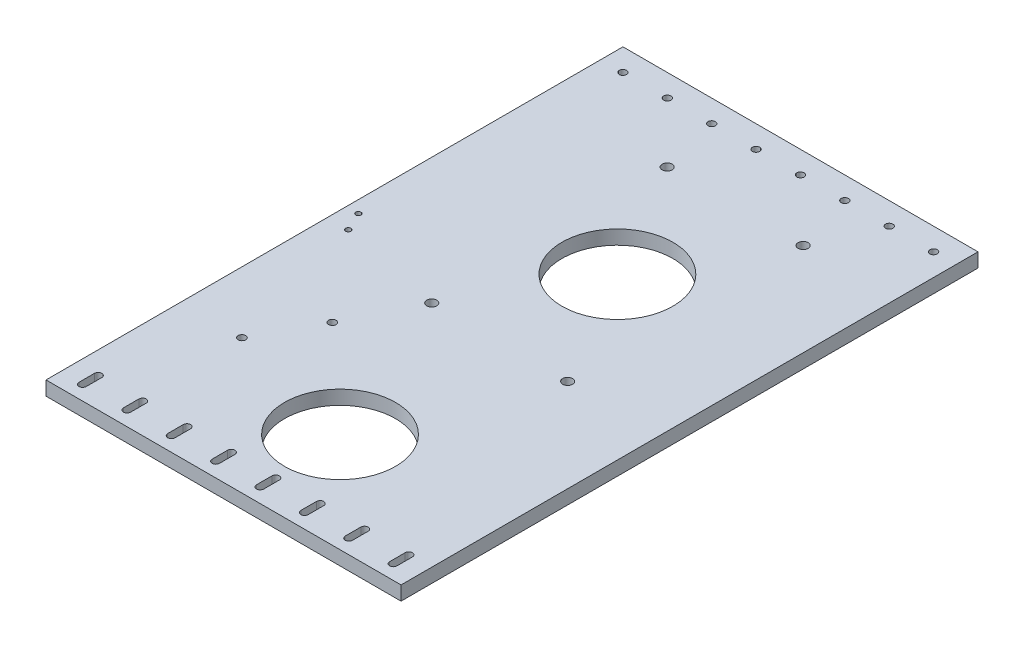
from build123d import *

# Parameters (mm, degrees)
SKETCH1_W           = 160
SKETCH1_H           = 260
SKETCH1_R           = 1.175
SKETCH1_R_2         = 2.25
SKETCH1_R_3         = 25
SKETCH1_R_4         = 1.65
BOSS_EXTRUDE1_DEPTH = 6.35
SKETCH2_R           = 1.7
CUT_EXTRUDE1_DEPTH  = 306.352783678


with BuildPart() as part:
    # Sketch1 → Boss-Extrude1 (new body)
    with BuildSketch(Plane(origin=(0, 0, 0), x_dir=(1, 0, 0), z_dir=(0, 1, 0))):
        with Locations((80, 130)):
            Rectangle(SKETCH1_W, SKETCH1_H)
        with BuildLine():
            ThreePointArc((11.65, 6.5), (10, 4.85), (8.35, 6.5))
            Line((8.35, 6.5), (8.35, 13.5))
            ThreePointArc((8.35, 13.5), (10, 15.15), (11.65, 13.5))
            Line((11.65, 13.5), (11.65, 6.5))
        make_face(mode=Mode.SUBTRACT)
        with BuildLine():
            Line((31.65, 13.5), (31.65, 6.5))
            ThreePointArc((31.65, 6.5), (30, 4.85), (28.35, 6.5))
            Line((28.35, 6.5), (28.35, 13.5))
            ThreePointArc((28.35, 13.5), (30, 15.15), (31.65, 13.5))
        make_face(mode=Mode.SUBTRACT)
        with BuildLine():
            Line((51.65, 13.5), (51.65, 6.5))
            ThreePointArc((51.65, 6.5), (50, 4.85), (48.35, 6.5))
            Line((48.35, 6.5), (48.35, 13.5))
            ThreePointArc((48.35, 13.5), (50, 15.15), (51.65, 13.5))
        make_face(mode=Mode.SUBTRACT)
        with BuildLine():
            Line((71.65, 13.5), (71.65, 6.5))
            ThreePointArc((71.65, 6.5), (70, 4.85), (68.35, 6.5))
            Line((68.35, 6.5), (68.35, 13.5))
            ThreePointArc((68.35, 13.5), (70, 15.15), (71.65, 13.5))
        make_face(mode=Mode.SUBTRACT)
        with Locations((9.516263037, 126.701090269)):
            Circle(SKETCH1_R, mode=Mode.SUBTRACT)
        with Locations((56.875, 116.955944018)):
            Circle(SKETCH1_R_2, mode=Mode.SUBTRACT)
        with BuildLine():
            Line((91.65, 13.5), (91.65, 6.5))
            ThreePointArc((91.65, 6.5), (90, 4.85), (88.35, 6.5))
            Line((88.35, 6.5), (88.35, 13.5))
            ThreePointArc((88.35, 13.5), (90, 15.15), (91.65, 13.5))
        make_face(mode=Mode.SUBTRACT)
        with BuildLine():
            Line((111.65, 13.5), (111.65, 6.5))
            ThreePointArc((111.65, 6.5), (110, 4.85), (108.35, 6.5))
            Line((108.35, 6.5), (108.35, 13.5))
            ThreePointArc((108.35, 13.5), (110, 15.15), (111.65, 13.5))
        make_face(mode=Mode.SUBTRACT)
        with Locations((87.5, 45)):
            Circle(SKETCH1_R_3, mode=Mode.SUBTRACT)
        with BuildLine():
            Line((131.65, 13.5), (131.65, 6.5))
            ThreePointArc((131.65, 6.5), (130, 4.85), (128.35, 6.5))
            Line((128.35, 6.5), (128.35, 13.5))
            ThreePointArc((128.35, 13.5), (130, 15.15), (131.65, 13.5))
        make_face(mode=Mode.SUBTRACT)
        with BuildLine():
            Line((151.65, 13.5), (151.65, 6.5))
            ThreePointArc((151.65, 6.5), (150, 4.85), (148.35, 6.5))
            Line((148.35, 6.5), (148.35, 13.5))
            ThreePointArc((148.35, 13.5), (150, 15.15), (151.65, 13.5))
        make_face(mode=Mode.SUBTRACT)
        with Locations((118.125, 116.955944018)):
            Circle(SKETCH1_R_2, mode=Mode.SUBTRACT)
        with Locations((5.475532842, 135.298909731)):
            Circle(SKETCH1_R, mode=Mode.SUBTRACT)
        with Locations((10, 250)):
            Circle(SKETCH1_R_4, mode=Mode.SUBTRACT)
        with Locations((30, 250)):
            Circle(SKETCH1_R_4, mode=Mode.SUBTRACT)
        with Locations((56.875, 223.044055982)):
            Circle(SKETCH1_R_2, mode=Mode.SUBTRACT)
        with Locations((50, 250)):
            Circle(SKETCH1_R_4, mode=Mode.SUBTRACT)
        with Locations((70, 250)):
            Circle(SKETCH1_R_4, mode=Mode.SUBTRACT)
        with Locations((87.5, 170)):
            Circle(SKETCH1_R_3, mode=Mode.SUBTRACT)
        with Locations((118.125, 223.044055982)):
            Circle(SKETCH1_R_2, mode=Mode.SUBTRACT)
        with Locations((90, 250)):
            Circle(SKETCH1_R_4, mode=Mode.SUBTRACT)
        with Locations((110, 250)):
            Circle(SKETCH1_R_4, mode=Mode.SUBTRACT)
        with Locations((130, 250)):
            Circle(SKETCH1_R_4, mode=Mode.SUBTRACT)
        with Locations((150, 250)):
            Circle(SKETCH1_R_4, mode=Mode.SUBTRACT)
    extrude(amount=BOSS_EXTRUDE1_DEPTH)

    # Sketch2 → Cut-Extrude1 (cut, through all)
    with BuildSketch(Plane(origin=(0, 6.35, 0), x_dir=(1, 0, 0), z_dir=(0, 1, 0))):
        with Locations((27.663890721, 60.64097268)):
            Circle(SKETCH2_R)
        with Locations((42.063890721, 86.95902732)):
            Circle(SKETCH2_R)
    extrude(amount=-CUT_EXTRUDE1_DEPTH, mode=Mode.SUBTRACT)


solid = part.part
